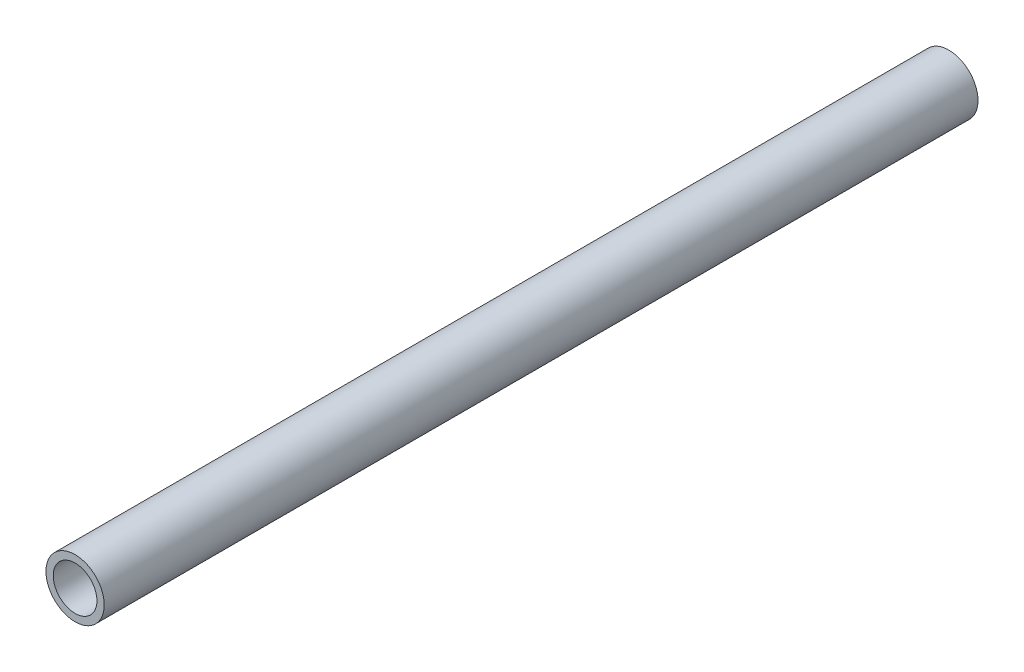
from build123d import *

# Parameters (mm, degrees)
IZIM1_R                     = 8
IZIM1_R_2                   = 6
Y_KSEKLIK_EKSTR_ZYON1_DEPTH = 240


with BuildPart() as part:
    # Çizim1 → Yükseklik-Ekstrüzyon1 (new body)
    with BuildSketch(Plane.XY):
        Circle(IZIM1_R)
        Circle(IZIM1_R_2, mode=Mode.SUBTRACT)
    extrude(amount=Y_KSEKLIK_EKSTR_ZYON1_DEPTH)


solid = part.part
